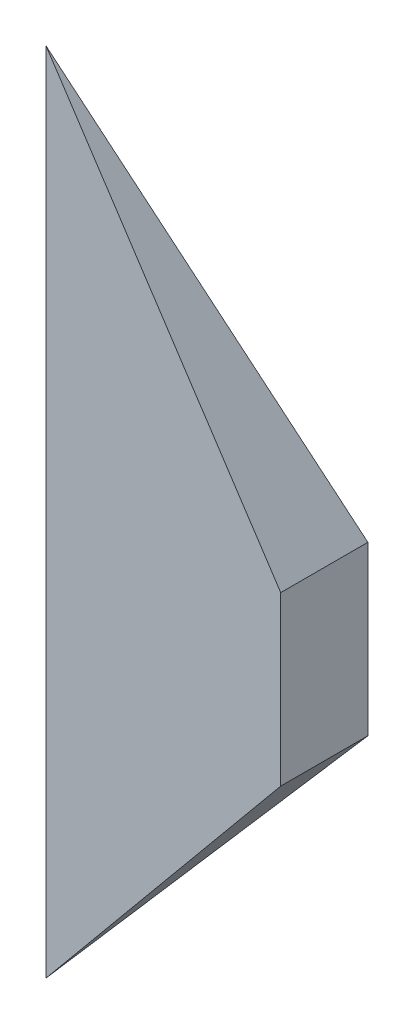
from build123d import *


with BuildPart() as part:
    # Esquisse1 → Lissage1 section 0
    with BuildSketch(Plane.XY):
        with BuildLine():
            Line((-6.999999999999566, -13.458548115672514), (-6.999999999999594, 10.624355652981228))
            Line((-6.999999999999594, 10.624355652981228), (0, -1.58e-15))
            Line((0, -1.58e-15), (5.83e-15, -5.000000000000009))
            Line((5.83e-15, -5.000000000000009), (-6.999999999999566, -13.458548115672514))
        make_face()
    # Esquisse2 → Lissage1 section 1
    with BuildSketch(Plane(origin=(0, 0, 0), x_dir=(0, 0, -1), z_dir=(1, 0, 0))):
        with BuildLine():
            Line((0, 0), (0, -5.000000000000009))
            Line((0, -5.000000000000009), (2.6, -5.000000000000009))
            Line((2.6, -5.000000000000009), (2.6, 0))
            Line((2.6, 0), (0, 0))
        make_face()
    loft()


solid = part.part
